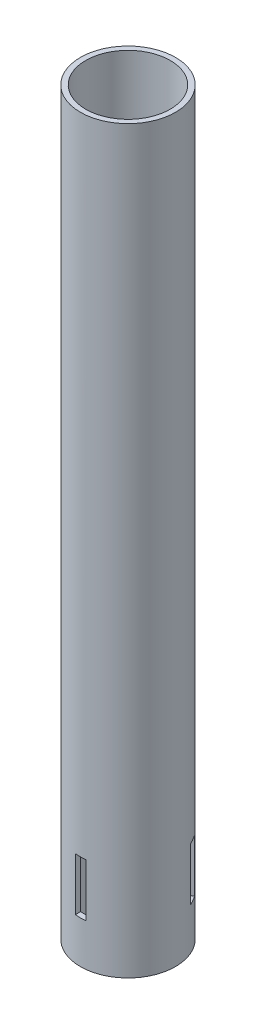
from build123d import *

# Parameters (mm, degrees)
SKETCH1_R           = 45
SKETCH1_R_2         = 40
BOSS_EXTRUDE2_DEPTH = 700
SKETCH2_W           = 10
SKETCH2_H           = 50
CUT_EXTRUDE4_DEPTH  = 62
CIRPATTERN1_COUNT   = 3


with BuildPart() as part:
    # Sketch1 → Boss-Extrude2 (new body)
    with BuildSketch(Plane(origin=(0, 0, 0), x_dir=(1, 0, 0), z_dir=(0, 1, 0))):
        with Locations(Location((0, 0, 0), (0, 0, 270))):
            Circle(SKETCH1_R)
        with Locations(Location((0, 0, 0), (0, 0, 270))):
            Circle(SKETCH1_R_2, mode=Mode.SUBTRACT)
    extrude(amount=BOSS_EXTRUDE2_DEPTH)

    # Sketch2 → Cut-Extrude4 (cut)
    with BuildSketch(Plane.XY):
        with Locations((0, 65)):
            Rectangle(SKETCH2_W, SKETCH2_H)
    cut_extrude4 = extrude(amount=CUT_EXTRUDE4_DEPTH, mode=Mode.SUBTRACT)

    # CirPattern1: Cut-Extrude4 ×3 about axis
    cirpattern1_axis = Axis((0, 0, 0), (0, 1, 0))
    for i in range(1, CIRPATTERN1_COUNT):
        add(cut_extrude4.rotate(cirpattern1_axis, i * 360 / CIRPATTERN1_COUNT), mode=Mode.SUBTRACT)


solid = part.part
